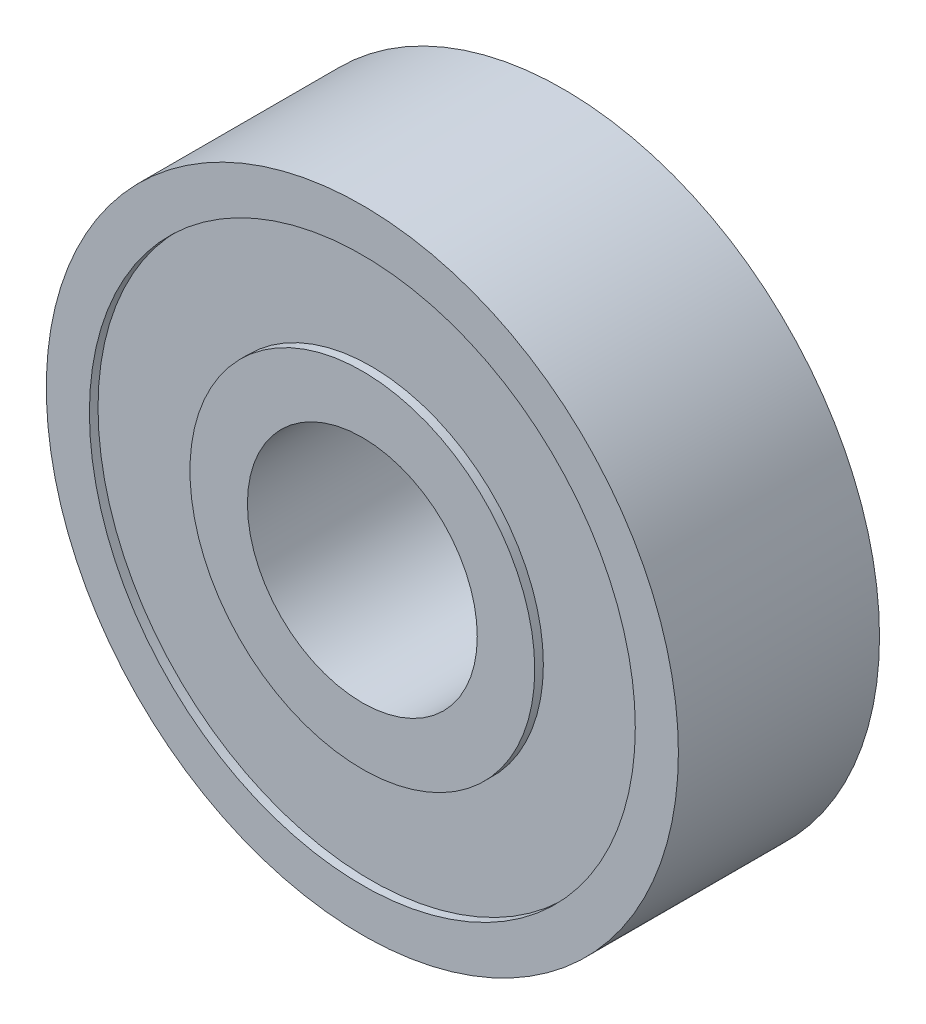
from build123d import *

# Parameters (mm, degrees)
SKETCH1_R        = 11
SKETCH1_R_2      = 9.5
OUTER_RING_DEPTH = 7
SKETCH2_R        = 6
SKETCH2_R_2      = 4
INNER_RING_DEPTH = 7
SKETCH3_R        = 9.5
SKETCH3_R_2      = 6
SHIELDS_DEPTH    = 6.4


with BuildPart() as part:
    # Sketch1 → Outer_ring (new body)
    with BuildSketch(Plane.XY):
        Circle(SKETCH1_R)
        Circle(SKETCH1_R_2, mode=Mode.SUBTRACT)
    extrude(amount=OUTER_RING_DEPTH)



with BuildPart() as body_2:
    # Sketch2 → Inner_ring (new body)
    with BuildSketch(Plane.XY):
        Circle(SKETCH2_R)
        Circle(SKETCH2_R_2, mode=Mode.SUBTRACT)
    extrude(amount=INNER_RING_DEPTH)


with BuildPart() as part_1:
    add(part.part)

    add(body_2.part)  # Shields merges body 2
    # Sketch3 → Shields (add)
    with BuildSketch(Plane.XY.offset(0.3)):
        Circle(SKETCH3_R)
        Circle(SKETCH3_R_2, mode=Mode.SUBTRACT)
    extrude(amount=SHIELDS_DEPTH)


solid = part_1.part
